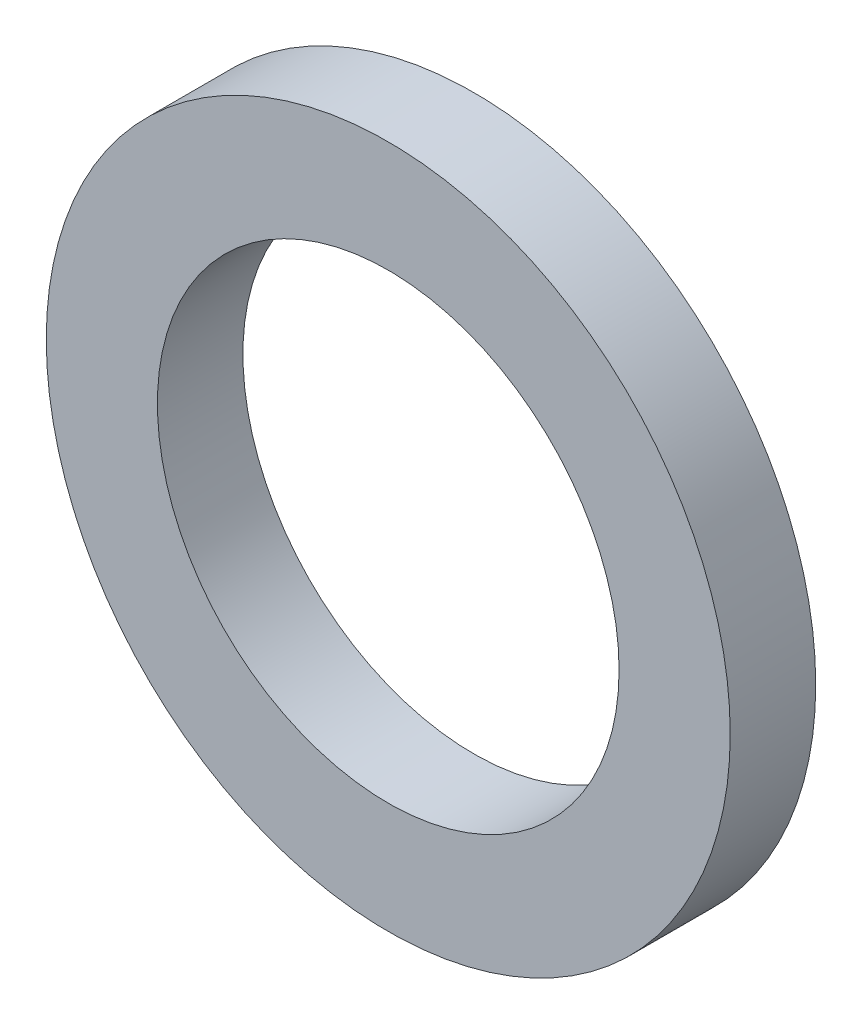
from build123d import *

# Parameters (mm, degrees)
PROFILE_1_R   = 6
PROFILE_1_R_2 = 4.05
RING_DEPTH    = 1.5


with BuildPart() as part:
    # Profile_1 → Ring (new body)
    with BuildSketch(Plane.XY):
        Circle(PROFILE_1_R)
        Circle(PROFILE_1_R_2, mode=Mode.SUBTRACT)
    extrude(amount=RING_DEPTH)


solid = part.part
